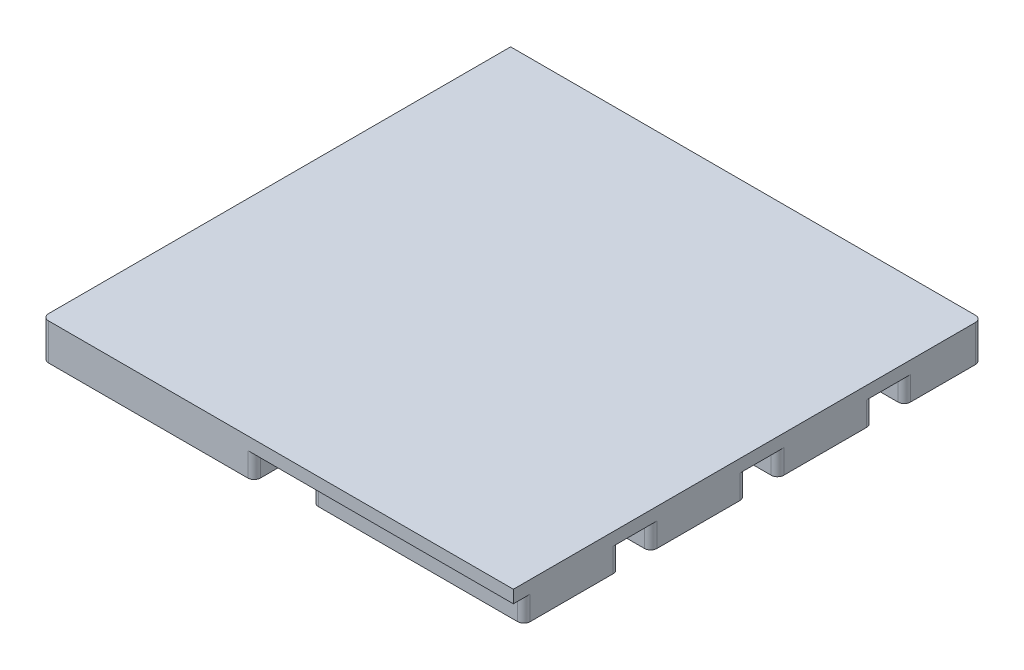
from build123d import *

# Parameters (mm, degrees)
SKETCH2_W           = 149
SKETCH2_H           = 148.13
BOSS_EXTRUDE1_DEPTH = 4
SKETCH3_W           = 67
SKETCH3_H           = 24.5
SKETCH3_H_2         = 30.2
SKETCH3_H_3         = 30.1967
BOSS_EXTRUDE3_DEPTH = 11.55
FILLET1_R           = 2


with BuildPart() as part:
    # Sketch2 → Boss-Extrude1 (new body)
    with BuildSketch(Plane(origin=(0, 0, 0), x_dir=(1, 0, 0), z_dir=(0, 1, 0))):
        with Locations((74.5, 74.065)):
            Rectangle(SKETCH2_W, SKETCH2_H)
    extrude(amount=BOSS_EXTRUDE1_DEPTH)

    # Sketch3 → Boss-Extrude3 (add)
    # profile 1 of 8: a face of its own
    with BuildSketch(Plane(origin=(0, 4, 0), x_dir=(1, 0, 0), z_dir=(0, 1, 0))):
        with Locations((33.5, 132.5467)):
            Rectangle(SKETCH3_W, SKETCH3_H)
        with BuildLine():
            ThreePointArc((12.85, 133.7967), (11.025, 135.6217), (12.85, 137.4467))
            Line((12.85, 137.4467), (40.15, 137.4467))
            ThreePointArc((40.15, 137.4467), (41.975, 135.6217), (40.15, 133.7967))
            Line((40.15, 133.7967), (12.85, 133.7967))
        make_face(mode=Mode.SUBTRACT)
    # profile 2 of 8: a face of its own
    with BuildSketch(Plane(origin=(0, 4, 0), x_dir=(1, 0, 0), z_dir=(0, 1, 0))):
        with Locations((115.5, 135.88)):
            Rectangle(SKETCH3_W, SKETCH3_H)
        with BuildLine():
            ThreePointArc((97.3, 136.48), (95.475, 138.305), (97.3, 140.13))
            Line((97.3, 140.13), (124.6, 140.13))
            ThreePointArc((124.6, 140.13), (126.425, 138.305), (124.6, 136.48))
            Line((124.6, 136.48), (97.3, 136.48))
        make_face(mode=Mode.SUBTRACT)
    # profile 3 of 8: a face of its own
    with BuildSketch(Plane(origin=(0, 4, 0), x_dir=(1, 0, 0), z_dir=(0, 1, 0))):
        with Locations((33.5, 95.2967)):
            Rectangle(SKETCH3_W, SKETCH3_H_2)
        with BuildLine():
            ThreePointArc((12.85, 92.4967), (11.05, 94.2967), (12.85, 96.0967))
            Line((12.85, 96.0967), (40.15, 96.0967))
            ThreePointArc((40.15, 96.0967), (41.95, 94.2967), (40.15, 92.4967))
            Line((40.15, 92.4967), (12.85, 92.4967))
        make_face(mode=Mode.SUBTRACT)
    # profile 4 of 8: a face of its own
    with BuildSketch(Plane(origin=(0, 4, 0), x_dir=(1, 0, 0), z_dir=(0, 1, 0))):
        with Locations((115.5, 98.63)):
            Rectangle(SKETCH3_W, SKETCH3_H_2)
        with BuildLine():
            ThreePointArc((97.3, 95.83), (95.5, 97.63), (97.3, 99.43))
            Line((97.3, 99.43), (124.6, 99.43))
            ThreePointArc((124.6, 99.43), (126.4, 97.63), (124.6, 95.83))
            Line((124.6, 95.83), (97.3, 95.83))
        make_face(mode=Mode.SUBTRACT)
    # profile 5 of 8: a face of its own
    with BuildSketch(Plane(origin=(0, 4, 0), x_dir=(1, 0, 0), z_dir=(0, 1, 0))):
        with Locations((33.5, 55.1967)):
            Rectangle(SKETCH3_W, SKETCH3_H_2)
        with BuildLine():
            ThreePointArc((12.85, 52.3967), (11.05, 54.1967), (12.85, 55.9967))
            Line((12.85, 55.9967), (40.15, 55.9967))
            ThreePointArc((40.15, 55.9967), (41.95, 54.1967), (40.15, 52.3967))
            Line((40.15, 52.3967), (12.85, 52.3967))
        make_face(mode=Mode.SUBTRACT)
    # profile 6 of 8: a face of its own
    with BuildSketch(Plane(origin=(0, 4, 0), x_dir=(1, 0, 0), z_dir=(0, 1, 0))):
        with Locations((115.5, 58.53)):
            Rectangle(SKETCH3_W, SKETCH3_H_2)
        with BuildLine():
            ThreePointArc((97.3, 55.73), (95.5, 57.53), (97.3, 59.33))
            Line((97.3, 59.33), (124.6, 59.33))
            ThreePointArc((124.6, 59.33), (126.4, 57.53), (124.6, 55.73))
            Line((124.6, 55.73), (97.3, 55.73))
        make_face(mode=Mode.SUBTRACT)
    # profile 7 of 8: a face of its own
    with BuildSketch(Plane(origin=(0, 4, 0), x_dir=(1, 0, 0), z_dir=(0, 1, 0))):
        with Locations((33.5, 15.09835)):
            Rectangle(SKETCH3_W, SKETCH3_H_3)
        with BuildLine():
            ThreePointArc((12.85, 12.2967), (11.05, 14.0967), (12.85, 15.8967))
            Line((12.85, 15.8967), (40.15, 15.8967))
            ThreePointArc((40.15, 15.8967), (41.95, 14.0967), (40.15, 12.2967))
            Line((40.15, 12.2967), (12.85, 12.2967))
        make_face(mode=Mode.SUBTRACT)
    # profile 8 of 8: a face of its own
    with BuildSketch(Plane(origin=(0, 4, 0), x_dir=(1, 0, 0), z_dir=(0, 1, 0))):
        with Locations((115.5, 18.43)):
            Rectangle(SKETCH3_W, SKETCH3_H_2)
        with BuildLine():
            ThreePointArc((97.3, 15.63), (95.5, 17.43), (97.3, 19.23))
            Line((97.3, 19.23), (124.6, 19.23))
            ThreePointArc((124.6, 19.23), (126.4, 17.43), (124.6, 15.63))
            Line((124.6, 15.63), (97.3, 15.63))
        make_face(mode=Mode.SUBTRACT)
    extrude(amount=-BOSS_EXTRUDE3_DEPTH)

    # Fillet1
    fillet1_edges = [part.edges().sort_by_distance(p)[0] for p in [
        (67, -3.775, -110.3967),
        (67, -3.775, -80.1967),
        (0, -3.775, -80.1967),
        (0, -3.775, -110.3967),
        (82, -3.775, -113.73),
        (149, -3.775, -113.73),
        (149, -3.775, -83.53),
        (82, -3.775, -83.53),
        (67, -3.775, -70.2967),
        (67, -3.775, -40.0967),
        (0, -3.775, -40.0967),
        (0, -3.775, -70.2967),
        (82, -3.775, -73.63),
        (149, -3.775, -73.63),
        (149, -3.775, -43.43),
        (82, -3.775, -43.43),
        (67, -3.775, -30.1967),
        (67, -3.775, 0),
        (0, -3.775, -30.1967),
        (67, -3.775, -144.7967),
        (67, -3.775, -120.2967),
        (0, -3.775, -120.2967),
        (0, -3.775, -144.7967),
        (82, -3.775, -33.53),
        (149, -3.775, -33.53),
        (149, -3.775, -3.33),
        (82, -3.775, -3.33),
        (82, -3.775, -148.13),
        (149, -3.775, -123.63),
        (82, -3.775, -123.63),
        (149, -1.775, -148.13),
        (0, -1.775, 0),
    ]]
    fillet(fillet1_edges, radius=FILLET1_R)


solid = part.part
